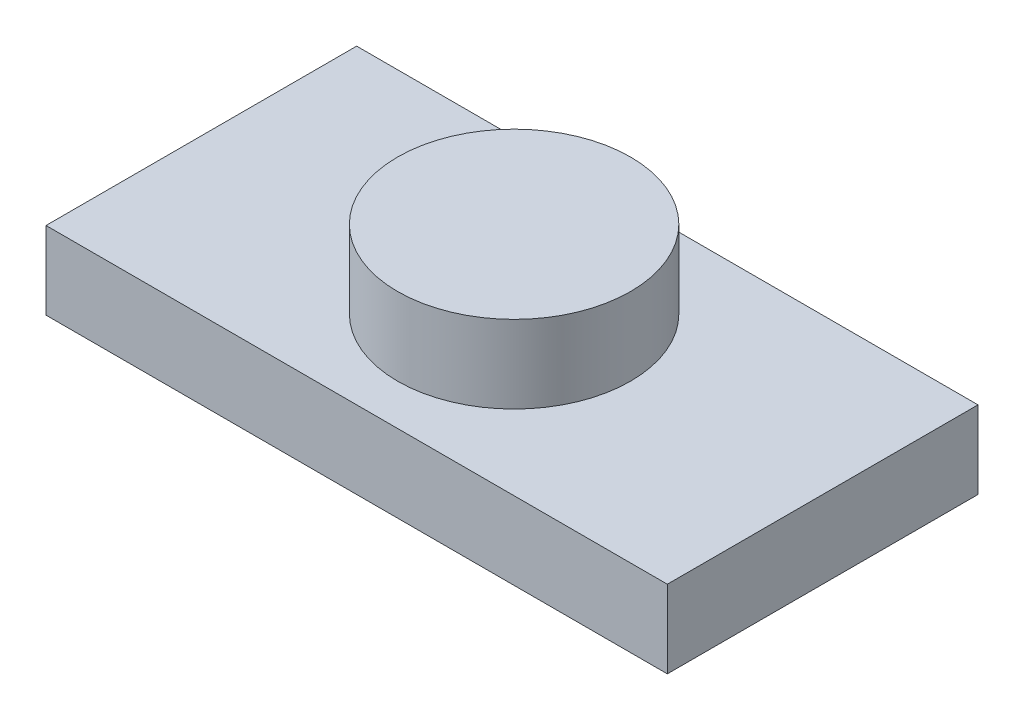
from build123d import *

# Parameters (mm, degrees)
SKETCH1_W           = 40
SKETCH1_H           = 5
BOSS_EXTRUDE2_DEPTH = 20
SKETCH3_R           = 7.5
BOSS_EXTRUDE3_DEPTH = 5


with BuildPart() as part:
    # Sketch1 → Boss-Extrude2 (new body)
    with BuildSketch(Plane.XY):
        with Locations((0, 3.122119816)):
            Rectangle(SKETCH1_W, SKETCH1_H)
    extrude(amount=BOSS_EXTRUDE2_DEPTH)

    # Sketch3 → Boss-Extrude3 (add)
    with BuildSketch(Plane(origin=(0, 5.622119816, 0), x_dir=(1, 0, 0), z_dir=(0, 1, 0))):
        with Locations(Location((0, -9.864916244, 0), (0, 0, 270))):
            Circle(SKETCH3_R)
    extrude(amount=BOSS_EXTRUDE3_DEPTH)


solid = part.part
